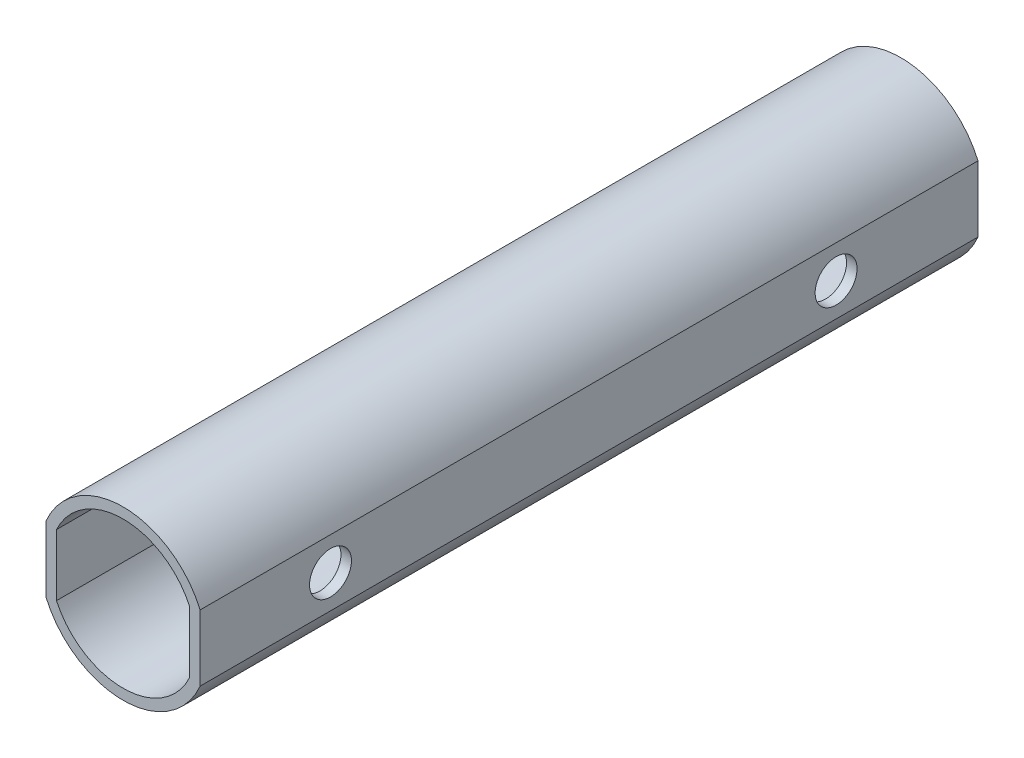
from build123d import *

# Parameters (mm, degrees)
BOSS_EXTRUDE1_DEPTH = 117.85
CUT_EXTRUDE1_REACH  = 122.81
SKETCH2_R           = 3.175


with BuildPart() as part:
    # Sketch1 → Boss-Extrude1 (new body)
    with BuildSketch(Plane.XY):
        with BuildLine():
            Line((11.674330816, 5), (11.674330816, -5))
            ThreePointArc((11.674330816, -5), (0, -12.7), (-11.674330816, -5))
            Line((-11.674330816, -5), (-11.674330816, 5))
            ThreePointArc((-11.674330816, 5), (0, 12.7), (11.674330816, 5))
        make_face()
        with BuildLine():
            Line((10.086830816, 4.662992638), (10.086830816, -4.662992638))
            ThreePointArc((10.086830816, -4.662992638), (0, -11.1125), (-10.086830816, -4.662992638))
            Line((-10.086830816, -4.662992638), (-10.086830816, 4.662992638))
            ThreePointArc((-10.086830816, 4.662992638), (0, 11.1125), (10.086830816, 4.662992638))
        make_face(mode=Mode.SUBTRACT)
    extrude(amount=BOSS_EXTRUDE1_DEPTH)

    # Cut-Extrude1: up to this face of the body (flat: up to its plane)
    cut_extrude1_end = Plane(part.part.faces().sort_by_distance((-11.674330816, 0, 58.925))[0])
    # Sketch2 → Cut-Extrude1 (cut, up to the picked face)
    with BuildSketch(Plane(origin=(11.674330816, 0, 0), x_dir=(0, 0, -1), z_dir=(1, 0, 0)), mode=Mode.PRIVATE) as cut_extrude1_sk1:
        with Locations((-21.5, 0)):
            Circle(SKETCH2_R)
    cut_extrude1_tool1 = split(extrude(cut_extrude1_sk1.sketch, amount=-CUT_EXTRUDE1_REACH, mode=Mode.PRIVATE), bisect_by=cut_extrude1_end, keep=Keep.BOTH, mode=Mode.PRIVATE)
    # Sketch2 → Cut-Extrude1 (cut, up to the picked face)
    with BuildSketch(Plane(origin=(11.674330816, 0, 0), x_dir=(0, 0, -1), z_dir=(1, 0, 0)), mode=Mode.PRIVATE) as cut_extrude1_sk2:
        with Locations((-98.1, 0)):
            Circle(SKETCH2_R)
    cut_extrude1_tool2 = split(extrude(cut_extrude1_sk2.sketch, amount=-CUT_EXTRUDE1_REACH, mode=Mode.PRIVATE), bisect_by=cut_extrude1_end, keep=Keep.BOTH, mode=Mode.PRIVATE)
    add(cut_extrude1_tool1.solids().sort_by(Axis((11.674331, 0, 21.5), (-1, 0, 0)))[0], mode=Mode.SUBTRACT)
    add(cut_extrude1_tool2.solids().sort_by(Axis((11.674331, 0, 98.1), (-1, 0, 0)))[0], mode=Mode.SUBTRACT)


solid = part.part
